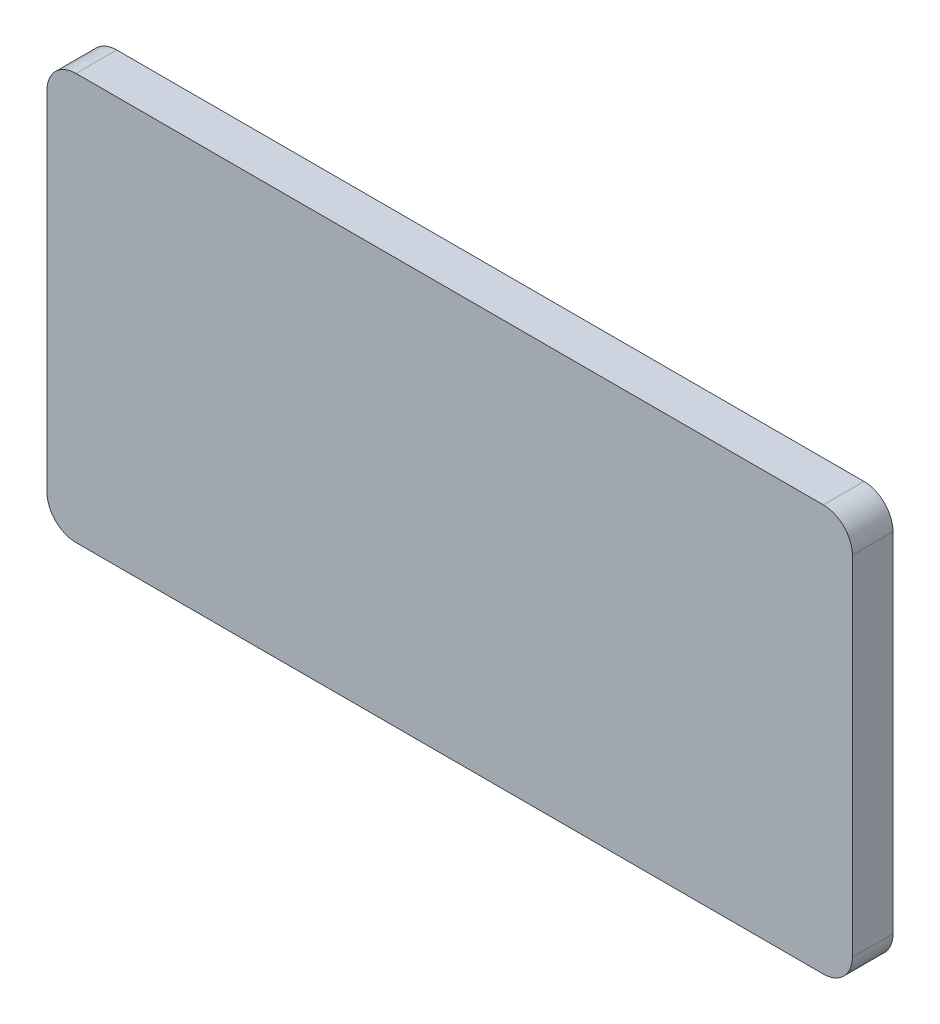
from build123d import *

# Parameters (mm, degrees)
BOSS_EXTRUDE1_DEPTH = 7


with BuildPart() as part:
    # Sketch1 → Boss-Extrude1 (new body)
    with BuildSketch(Plane.XY):
        with BuildLine():
            Line((-65.623145401, 35), (63.130563798, 35))
            ThreePointArc((63.130563798, 35), (66.666097704, 33.535533906), (68.130563798, 30))
            Line((68.130563798, 30), (68.130563798, -30))
            ThreePointArc((68.130563798, -30), (66.666097704, -33.535533906), (63.130563798, -35))
            Line((63.130563798, -35), (-65.623145401, -35))
            ThreePointArc((-65.623145401, -35), (-69.158679307, -33.535533906), (-70.623145401, -30))
            Line((-70.623145401, -30), (-70.623145401, 30))
            ThreePointArc((-70.623145401, 30), (-69.158679307, 33.535533906), (-65.623145401, 35))
        make_face()
    extrude(amount=BOSS_EXTRUDE1_DEPTH)


solid = part.part
